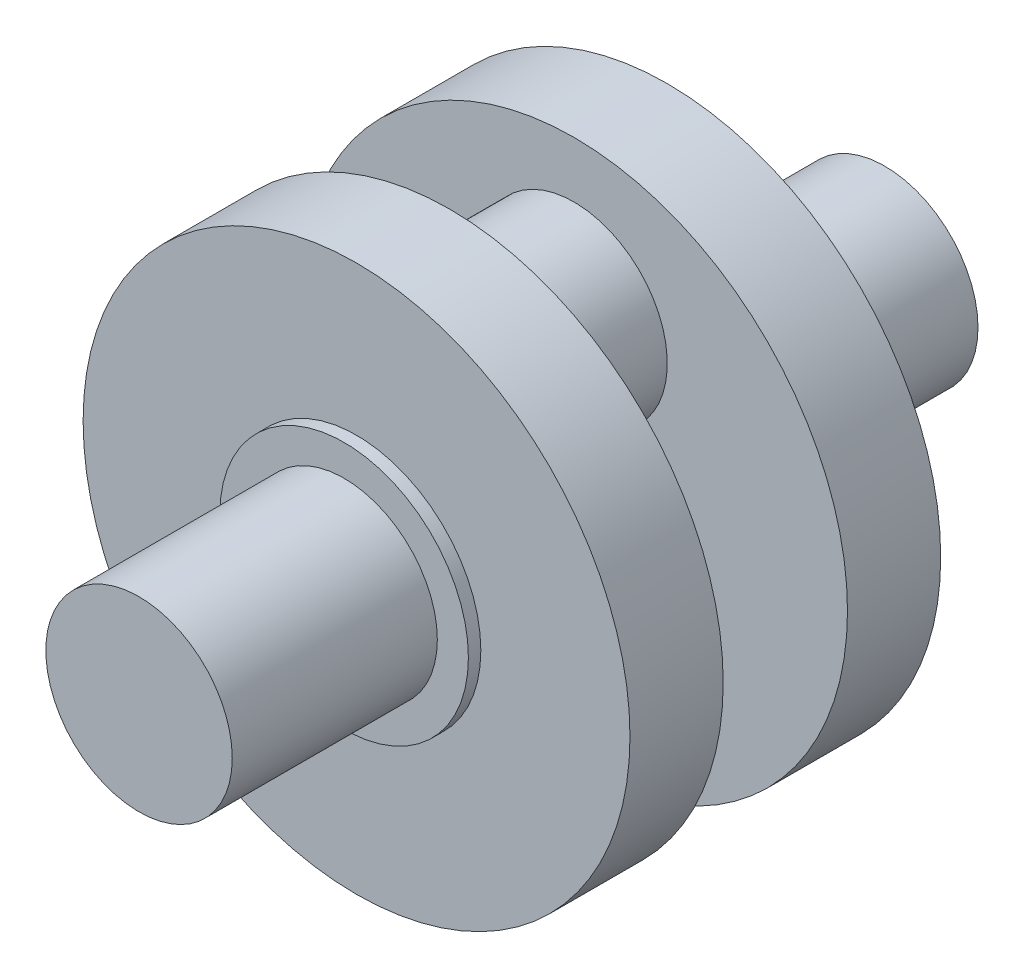
from build123d import *

# Parameters (mm, degrees)
SZKIC1_R                    = 15
DODANIE_WYCI_GNI_CIE1_DEPTH = 33
SZKIC2_R                    = 20
DODANIE_WYCI_GNI_CIE2_DEPTH = 2
SZKIC5_R                    = 44
DODANIE_WYCI_GNI_CIE5_DEPTH = 15
SZKIC6_R                    = 15
DODANIE_WYCI_GNI_CIE6_DEPTH = 10


with BuildPart() as part:
    # Szkic1 → Dodanie-wyciągnięcie1 (new body)
    with BuildSketch(Plane.XY):
        Circle(SZKIC1_R)
    extrude(amount=DODANIE_WYCI_GNI_CIE1_DEPTH)

    # Szkic2 → Dodanie-wyciągnięcie2 (add)
    with BuildSketch(Plane.XY):
        Circle(SZKIC2_R)
    extrude(amount=-DODANIE_WYCI_GNI_CIE2_DEPTH)

    # Szkic5 → Dodanie-wyciągnięcie5 (add)
    with BuildSketch(Plane(origin=(0, 0, -2), x_dir=(-1, 0, 0), z_dir=(0, 0, -1))):
        Circle(SZKIC5_R)
    extrude(amount=DODANIE_WYCI_GNI_CIE5_DEPTH)

    # Szkic6 → Dodanie-wyciągnięcie6 (add)
    with BuildSketch(Plane(origin=(0, 0, -17), x_dir=(-1, 0, 0), z_dir=(0, 0, -1))):
        with Locations((0, 20)):
            Circle(SZKIC6_R)
    extrude(amount=DODANIE_WYCI_GNI_CIE6_DEPTH)

    # Lustro3: part across plane


with BuildPart() as part_1:
    add(part.part)
    add(part.part.mirror(Plane(origin=(0, 20, -27), x_dir=(1, 0, 0), z_dir=(0, 0, -1))))


solid = part_1.part
